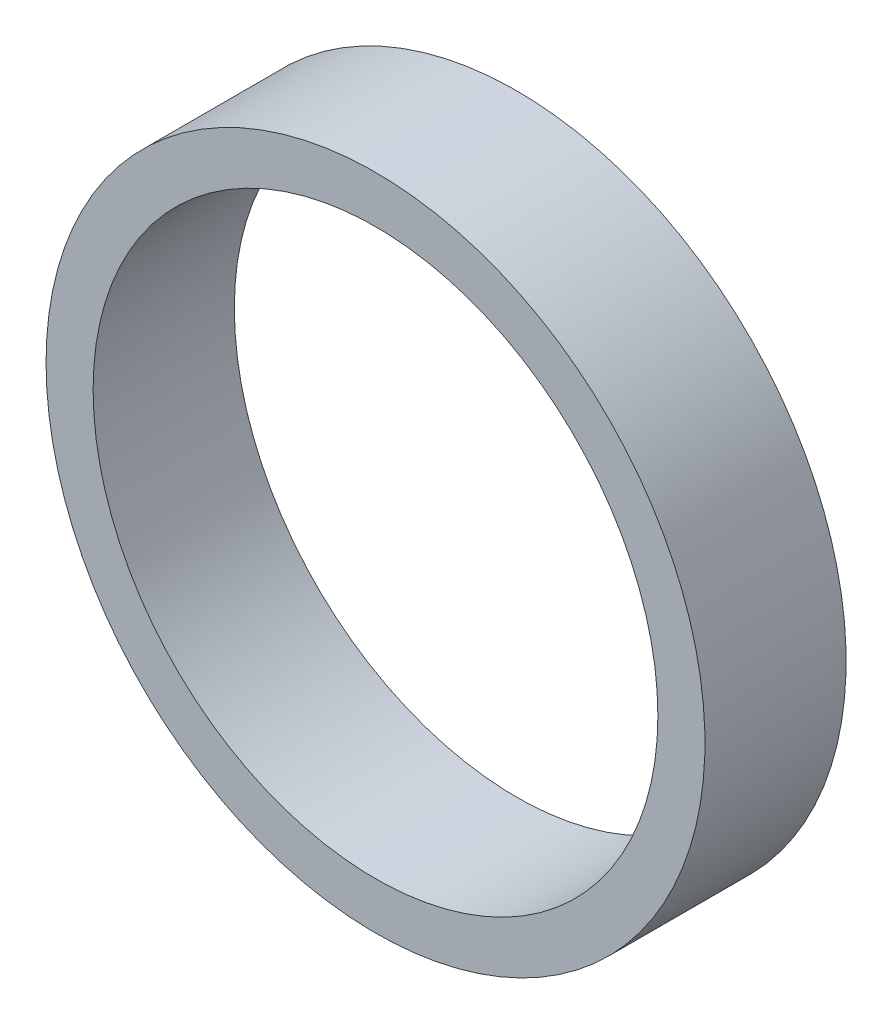
from build123d import *

# Parameters (mm, degrees)
SKETCH1_R           = 22.225
SKETCH1_R_2         = 19.05
BOSS_EXTRUDE1_DEPTH = 9.525


with BuildPart() as part:
    # Sketch1 → Boss-Extrude1 (new body)
    with BuildSketch(Plane.XY):
        with Locations(Location((0, 0, 0), (0, 0, 180))):
            Circle(SKETCH1_R)
        with Locations(Location((0, 0, 0), (0, 0, 180))):
            Circle(SKETCH1_R_2, mode=Mode.SUBTRACT)
    extrude(amount=BOSS_EXTRUDE1_DEPTH)


solid = part.part
